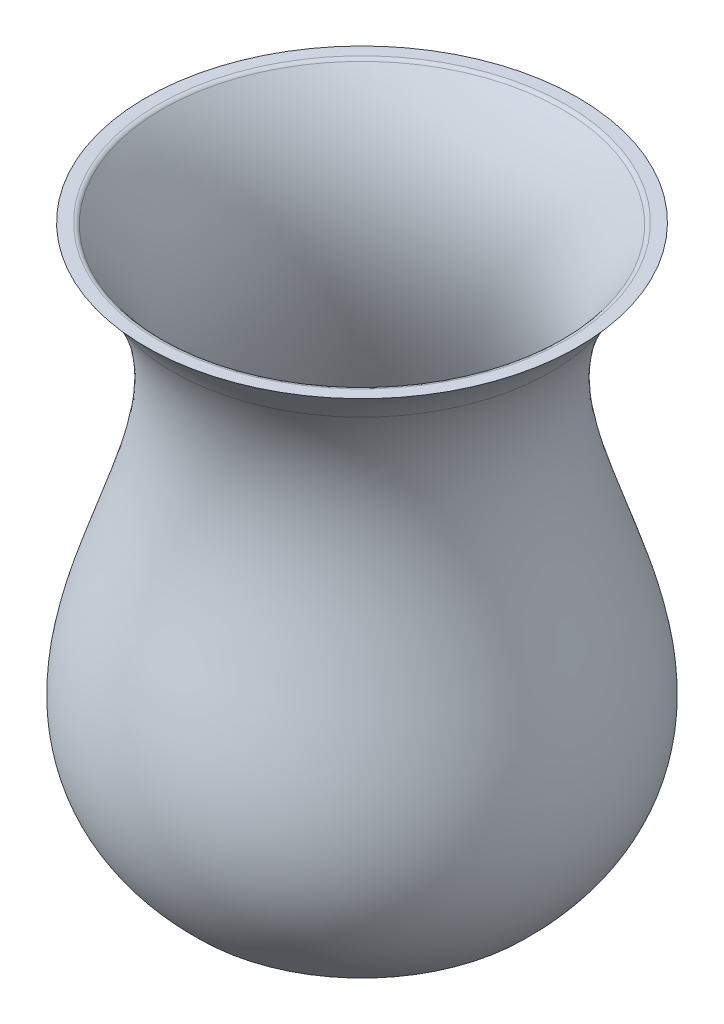
from build123d import *

# Parameters (mm, degrees)
SHELL26_T = -2
FILLET1_R = 1


with BuildPart() as part:
    # Sketch1 → Revolve2 (revolve)
    with BuildSketch(Plane.XY):
        with BuildLine():
            Line((40, 100), (0, 100))
            Line((0, 100), (0, 0))
            Line((0, 0), (30, 0))
            add(Edge.make_bspline(
                [(40, 100), (8.214298289, 65.676365866), (63.629973381, 31.703163026), (30, 0)],
                knots=[0, 0, 0, 0, 1, 1, 1, 1], degree=3))
        make_face()
    revolve(axis=Axis((0, 0, 0), (0, 1, 0)))

    # Shell26
    shell26_openings = [part.faces().sort_by_distance(p)[0] for p in [
        (0, 100, 0),
    ]]
    offset(amount=SHELL26_T, openings=shell26_openings, kind=Kind.INTERSECTION)

    # Fillet1
    fillet1_edges = [part.edges().sort_by_distance(p)[0] for p in [
        (-37.317425183, 100, 0),
        (-29.196581379, 2, 0),
    ]]
    fillet(fillet1_edges, radius=FILLET1_R)


solid = part.part
